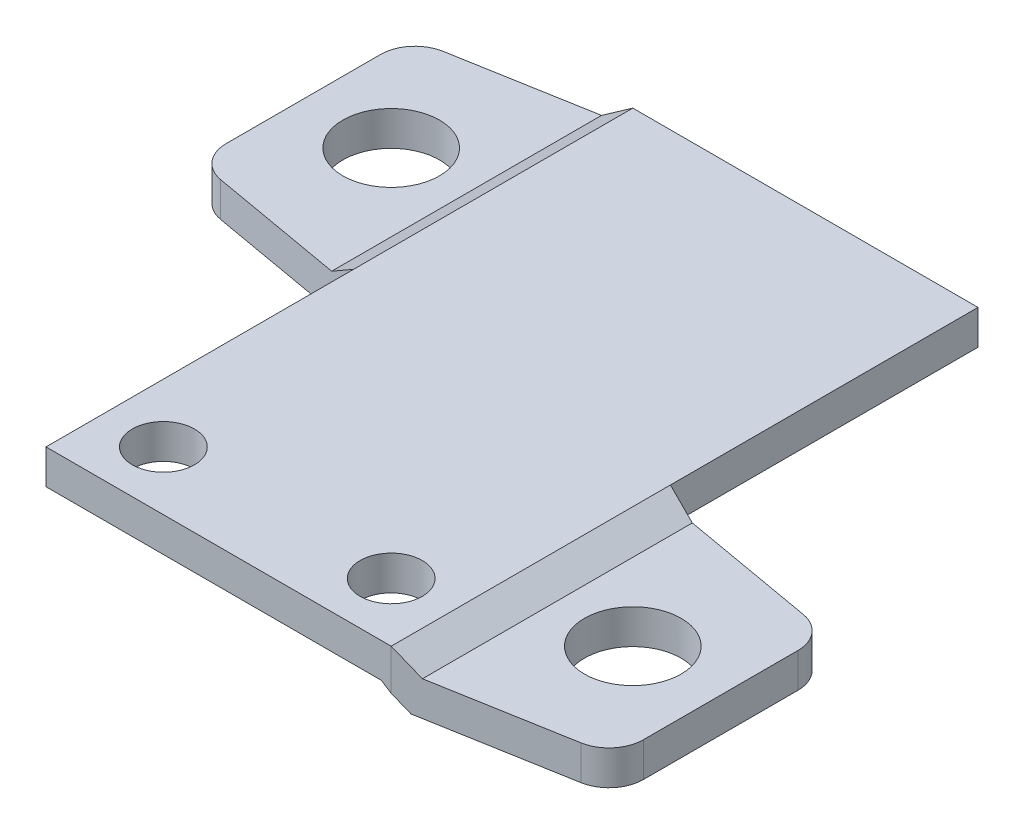
from build123d import *

# Parameters (mm, degrees)
BOSS_EXTRUDE1_DEPTH = 8.5
SKETCH2_R           = 0.9
SKETCH2_R_2         = 1.4
CUT_EXTRUDE1_DEPTH  = 14.592277219
CUT_EXTRUDE2_DEPTH  = 14.592277219
CUT_EXTRUDE3_REACH  = 22.037
CUT_EXTRUDE4_REACH  = 22.037
FILLET1_R           = 1


with BuildPart() as part:
    # Sketch1 → Boss-Extrude1 (new, symmetric)
    with BuildSketch(Plane.XY):
        Polygon((-5, 0), (5, 0), (5.769932482, -0.5), (10.5, -0.5), (10.5, -1.5), (5.487, -1.5), (4.717067518, -1), (-4.717067518, -1), (-5.487, -1.5), (-10.5, -1.5), (-10.5, -0.5), (-5.769932482, -0.5), align=None)
    extrude(amount=BOSS_EXTRUDE1_DEPTH, both=True)

    # Sketch2 → Cut-Extrude1 (cut, through all)
    with BuildSketch(Plane(origin=(0, 0, 0), x_dir=(1, 0, 0), z_dir=(0, 1, 0))):
        with Locations(Location((-3.3, -6.8, 0), (0, 0, 270))):
            Circle(SKETCH2_R)
        with Locations(Location((3.3, -6.8, 0), (0, 0, 270))):
            Circle(SKETCH2_R)
        with Locations(Location((8, -4.5, 0), (0, 0, 270))):
            Circle(SKETCH2_R_2)
        with Locations(Location((-8, 4.5, 0), (0, 0, 270))):
            Circle(SKETCH2_R_2)
    extrude(amount=-CUT_EXTRUDE1_DEPTH, mode=Mode.SUBTRACT)

    # Sketch3 → Cut-Extrude2 (cut, through all)
    with BuildSketch(Plane(origin=(0, 0, 0), x_dir=(1, 0, 0), z_dir=(0, 1, 0))):
        Polygon((5, -8.5), (10.5, -7.530201606), (10.5, -8.5), align=None)
        Polygon((10.5, -1.38), (5, -0.410201606), (5, 8.5), (10.5, 8.5), align=None)
        Polygon((-10.5, 8.5), (-5, 8.5), (-10.5, 7.530201606), align=None)
        Polygon((-10.5, 1.38), (-5, 0.410201606), (-5, -8.5), (-10.5, -8.5), align=None)
    extrude(amount=-CUT_EXTRUDE2_DEPTH, mode=Mode.SUBTRACT)

    # Cut-Extrude3: up to this face of the body (flat: up to its plane)
    cut_extrude3_end = Plane(part.part.faces().sort_by_distance((-7.700021392, -0.971737286, -0.886288226))[0])
    # Sketch4 → Cut-Extrude3 (cut, up to the picked face)
    with BuildSketch(Plane.XY.offset(8.5), mode=Mode.PRIVATE) as cut_extrude3_sk1:
        Polygon((-5, -1.183738502), (-4.717067518, -1), (-5, -1), align=None)
    cut_extrude3_tool1 = split(extrude(cut_extrude3_sk1.sketch, amount=-CUT_EXTRUDE3_REACH, mode=Mode.PRIVATE), bisect_by=cut_extrude3_end, keep=Keep.BOTH, mode=Mode.PRIVATE)
    add(cut_extrude3_tool1.solids().sort_by(Axis((-4.905689, -1.061246, 8.5), (0, 0, -1)))[0], mode=Mode.SUBTRACT)

    # Cut-Extrude4: up to this face of the body (flat: up to its plane)
    cut_extrude4_end = Plane(part.part.faces().sort_by_distance((7.700021392, -0.971737286, 0.886288226))[0])
    # Sketch5 → Cut-Extrude4 (cut, up to the picked face)
    with BuildSketch(Plane(origin=(0, 0, -8.5), x_dir=(-1, 0, 0), z_dir=(0, 0, -1)), mode=Mode.PRIVATE) as cut_extrude4_sk1:
        Polygon((-5, -1.183738502), (-4.717067518, -1), (-5, -1), align=None)
    cut_extrude4_tool1 = split(extrude(cut_extrude4_sk1.sketch, amount=-CUT_EXTRUDE4_REACH, mode=Mode.PRIVATE), bisect_by=cut_extrude4_end, keep=Keep.BOTH, mode=Mode.PRIVATE)
    add(cut_extrude4_tool1.solids().sort_by(Axis((4.905689, -1.061246, -8.5), (0, 0, 1)))[0], mode=Mode.SUBTRACT)

    # Fillet1
    fillet1_edges = [part.edges().sort_by_distance(p)[0] for p in [
        (-10.5, -1, -1.38),
        (10.5, -1, 7.530201606),
        (10.5, -1, 1.38),
        (-10.5, -1, -7.530201606),
    ]]
    fillet(fillet1_edges, radius=FILLET1_R)


solid = part.part
